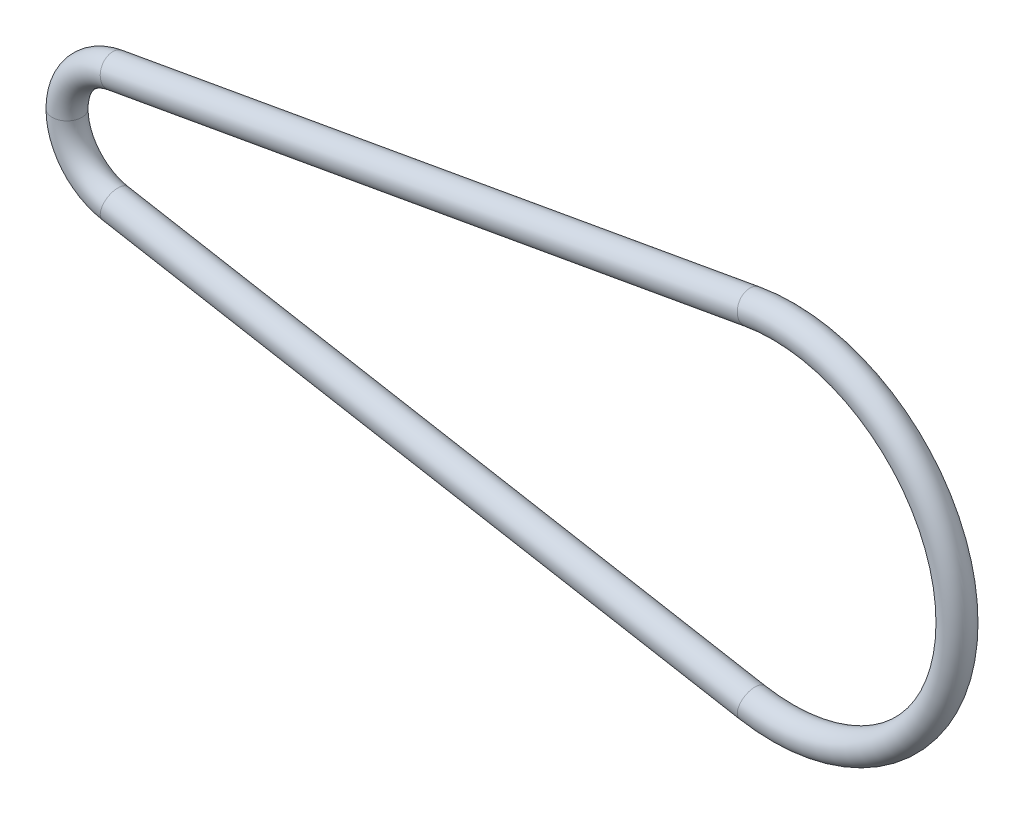
from build123d import *

# Parameters (mm, degrees)
SKETCH2_R = 1.3081


with BuildPart() as part:
    # Sweep1: sweep along a path in Sketch1
    with BuildLine(Plane.XY) as sweep1_path:
        Line((-0.905793553, 5.076015808), (55.14485729, 15.078017399))
        ThreePointArc((55.14485729, 15.078017399), (73.151665726, 0), (55.14485729, -15.078017399))
        Line((55.14485729, -15.078017399), (-0.905793553, -5.076015808))
        ThreePointArc((-0.905793553, -5.076015808), (-5.1562, 0), (-0.905793553, 5.076015808))
    # Sketch2 → Sweep1 (sweep)
    with BuildSketch(Plane(origin=(0, 0, 0), x_dir=(1, 0, 0), z_dir=(0, 1, 0))):
        with Locations((-5.1562, 0)):
            Circle(SKETCH2_R)
    sweep(path=sweep1_path.line)


solid = part.part
